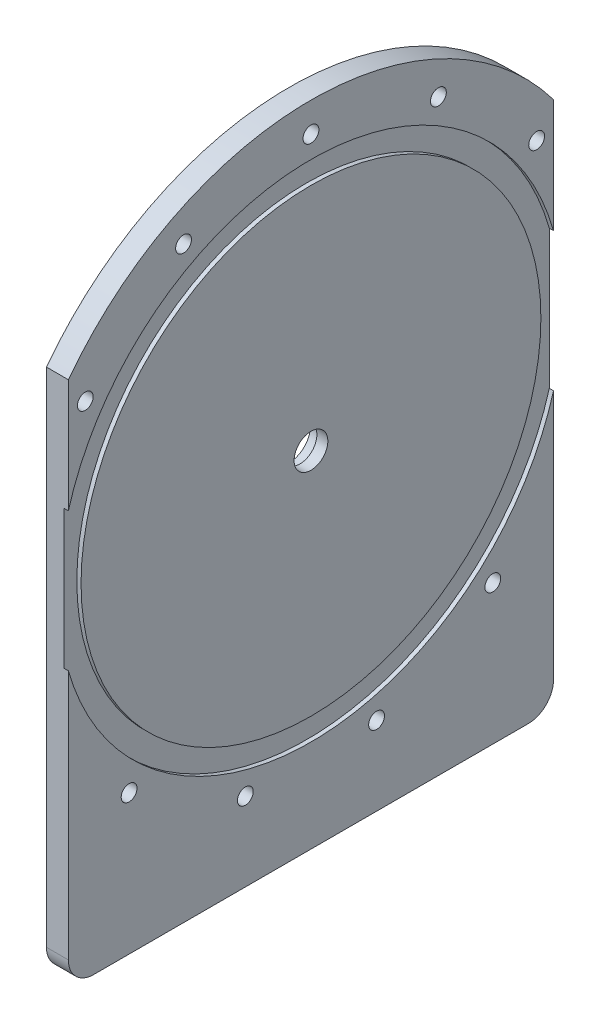
from build123d import *

# Parameters (mm, degrees)
SKETCH1_R           = 5.08
BOSS_EXTRUDE1_DEPTH = 6.604
SKETCH2_R           = 6.477
CUT_EXTRUDE1_DEPTH  = 3.302
SKETCH3_R           = 75.946
SKETCH3_R_2         = 69.215
CUT_EXTRUDE2_DEPTH  = 1.27
SKETCH4_R           = 2.38125
CUT_EXTRUDE3_DEPTH  = 139.530727768
SKETCH6_W           = 37.512644612
SKETCH6_H           = 125.02997604
SKETCH6_W_2         = 29.936636925
CUT_EXTRUDE6_DEPTH  = 139.530727768


with BuildPart() as part:
    # Sketch1 → Boss-Extrude1 (new body)
    with BuildSketch(Plane(origin=(0, 0, 0), x_dir=(0, 0, -1), z_dir=(1, 0, 0))):
        with BuildLine():
            Line((-65.405, -103.855072673), (65.405, -103.855072673))
            ThreePointArc((65.405, -103.855072673), (70.793153673, -101.623226346), (73.025, -96.235072673))
            Line((73.025, -96.235072673), (73.025, -69.997049759))
            ThreePointArc((73.025, -69.997049759), (74.696702219, -57.072253546), (79.601785714, -44.998103417))
            ThreePointArc((79.601785714, -44.998103417), (0, 91.44), (-79.601785714, -44.998103417))
            ThreePointArc((-79.601785714, -44.998103417), (-74.696702219, -57.072253546), (-73.025, -69.997049759))
            Line((-73.025, -69.997049759), (-73.025, -96.235072673))
            ThreePointArc((-73.025, -96.235072673), (-70.793153673, -101.623226346), (-65.405, -103.855072673))
        make_face()
        with Locations(Location((0, 0, 0), (0, 0, 180))):
            Circle(SKETCH1_R, mode=Mode.SUBTRACT)
    extrude(amount=BOSS_EXTRUDE1_DEPTH)

    # Sketch2 → Cut-Extrude1 (cut)
    with BuildSketch(Plane(origin=(0, 0, 0), x_dir=(0, 0, -1), z_dir=(1, 0, 0))):
        with Locations(Location((0, 0, 0), (0, 0, 180))):
            Circle(SKETCH2_R)
    extrude(amount=CUT_EXTRUDE1_DEPTH, mode=Mode.SUBTRACT)

    # Sketch3 → Cut-Extrude2 (cut)
    with BuildSketch(Plane(origin=(6.604, 0, 0), x_dir=(0, 0, -1), z_dir=(1, 0, 0))):
        Circle(SKETCH3_R)
        Circle(SKETCH3_R_2, mode=Mode.SUBTRACT)
    extrude(amount=-CUT_EXTRUDE2_DEPTH, mode=Mode.SUBTRACT)

    # Sketch4 → Cut-Extrude3 (cut, through all)
    with BuildSketch(Plane.ZY):
        with Locations((-54.740775438, -61.789562262)):
            Circle(SKETCH4_R)
        with Locations((0, 82.55)):
            Circle(SKETCH4_R)
        with Locations((-77.185590834, -29.272633425)):
            Circle(SKETCH4_R)
        with Locations((38.362897852, 73.094394918)):
            Circle(SKETCH4_R)
        with Locations((67.93731813, 46.893744843)):
            Circle(SKETCH4_R)
        with Locations((81.948117557, 9.950302955)):
            Circle(SKETCH4_R)
        with Locations((77.185590834, -29.272633425)):
            Circle(SKETCH4_R)
        with Locations((54.740775438, -61.789562262)):
            Circle(SKETCH4_R)
        with Locations((19.755508087, -80.151247029)):
            Circle(SKETCH4_R)
        with Locations((-19.755508087, -80.151247029)):
            Circle(SKETCH4_R)
        with Locations((-81.948117557, 9.950302955)):
            Circle(SKETCH4_R)
        with Locations((-67.93731813, 46.893744843)):
            Circle(SKETCH4_R)
        with Locations((-38.362897852, 73.094394918)):
            Circle(SKETCH4_R)
    extrude(amount=-CUT_EXTRUDE3_DEPTH, mode=Mode.SUBTRACT)

    # Sketch6 → Cut-Extrude6 (cut, through all)
    with BuildSketch(Plane(origin=(6.604, 0, 0), x_dir=(0, 0, -1), z_dir=(1, 0, 0))):
        with Locations((-91.781322306, -7.482061739)):
            Rectangle(SKETCH6_W, SKETCH6_H)
        with Locations((87.993318463, -7.482061739)):
            Rectangle(SKETCH6_W_2, SKETCH6_H)
    extrude(amount=-CUT_EXTRUDE6_DEPTH, mode=Mode.SUBTRACT)


solid = part.part
